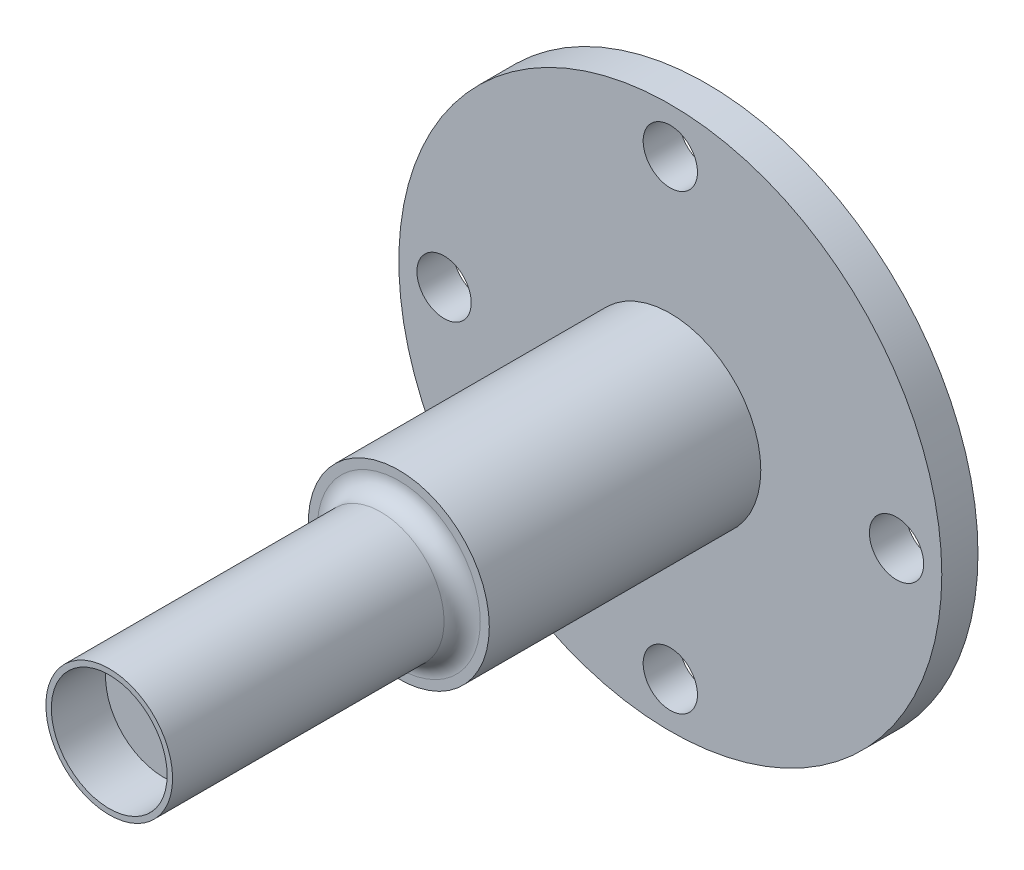
from build123d import *

# Parameters (mm, degrees)
SKETCH1_R           = 15
SKETCH1_R_2         = 1.5
SKETCH1_R_3         = 5
BOSS_EXTRUDE1_DEPTH = 2
SKETCH1_3_R         = 5
SKETCH1_3_R_2       = 3.5
SKETCH1_3_R_3       = 3.2
BOSS_EXTRUDE2_DEPTH = 17
BOSS_EXTRUDE3_START = 17
SKETCH1_4_R         = 3.5
SKETCH1_4_R_2       = 3.2
BOSS_EXTRUDE3_DEPTH = 16
SKETCH2_R           = 3.2
BOSS_EXTRUDE4_DEPTH = 13
FILLET1_R           = 1


with BuildPart() as part:
    # Sketch1 → Boss-Extrude1 (new body)
    with BuildSketch(Plane.XY):
        Circle(SKETCH1_R)
        with Locations((0, 12.5)):
            Circle(SKETCH1_R_2, mode=Mode.SUBTRACT)
        with Locations((12.5, 0)):
            Circle(SKETCH1_R_2, mode=Mode.SUBTRACT)
        with Locations((0, -12.5)):
            Circle(SKETCH1_R_2, mode=Mode.SUBTRACT)
        with Locations((-12.5, 0)):
            Circle(SKETCH1_R_2, mode=Mode.SUBTRACT)
        Circle(SKETCH1_R_3, mode=Mode.SUBTRACT)
    extrude(amount=BOSS_EXTRUDE1_DEPTH)

    # Sketch1<3> → Boss-Extrude2 (add)
    # profile 1 of 3: a face of its own
    with BuildSketch(Plane.XY):
        Circle(SKETCH1_3_R)
        Circle(SKETCH1_3_R_2, mode=Mode.SUBTRACT)
    # profile 2 of 3: a face of its own
    with BuildSketch(Plane.XY):
        Circle(SKETCH1_3_R_2)
        Circle(SKETCH1_3_R_3, mode=Mode.SUBTRACT)
    # profile 3 of 3: a face of its own
    with BuildSketch(Plane.XY):
        Circle(SKETCH1_3_R_3)
    extrude(amount=BOSS_EXTRUDE2_DEPTH)

    # Sketch1<4> → Boss-Extrude3 (add)
    with BuildSketch(Plane.XY.offset(BOSS_EXTRUDE3_START)):
        Circle(SKETCH1_4_R)
        Circle(SKETCH1_4_R_2, mode=Mode.SUBTRACT)
    extrude(amount=BOSS_EXTRUDE3_DEPTH)

    # Sketch2 → Boss-Extrude4 (add)
    with BuildSketch(Plane.XY.offset(17)):
        Circle(SKETCH2_R)
    extrude(amount=BOSS_EXTRUDE4_DEPTH)

    # Fillet1
    fillet1_edges = [part.edges().sort_by_distance(p)[0] for p in [
        (-3.5, 0, 17),
    ]]
    fillet(fillet1_edges, radius=FILLET1_R)


solid = part.part
